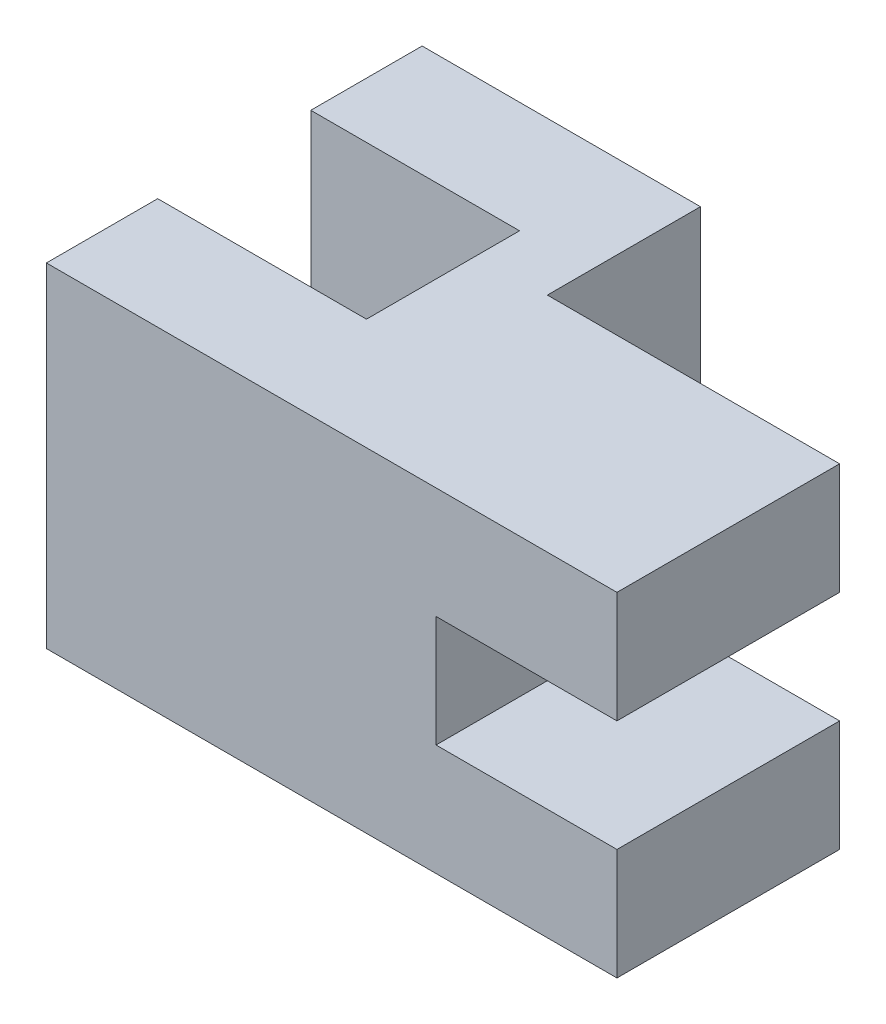
from build123d import *

# Parameters (mm, degrees)
EXTRUDE_1_DEPTH     = 12
SKETCH_2_W          = 13
SKETCH_2_H          = 8
CUT_EXTRUDE_1_DEPTH = 24


with BuildPart() as part:
    # 草图1 → 凸台-拉伸1 (new, symmetric)
    with BuildSketch(Plane(origin=(0, 0, 0), x_dir=(1, 0, 0), z_dir=(0, 1, 0))):
        Polygon((0, 11), (0, 0), (-15, 0), (-15, -8), (26, -8), (26, 8), (5, 8), (5, 19), (-15, 19), (-15, 11), align=None)
    extrude(amount=EXTRUDE_1_DEPTH, both=True)

    # 草图2 → 切除-拉伸1 (cut)
    with BuildSketch(Plane.XY.offset(8)):
        with Locations((19.5, 0)):
            Rectangle(SKETCH_2_W, SKETCH_2_H)
    extrude(amount=-CUT_EXTRUDE_1_DEPTH, mode=Mode.SUBTRACT)


solid = part.part
